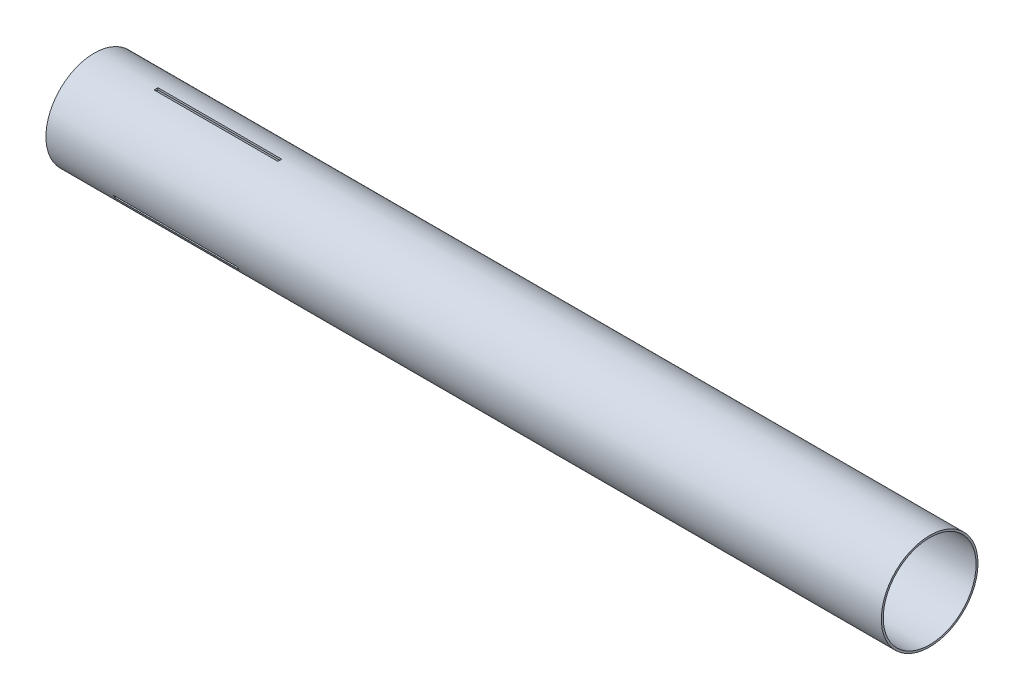
from build123d import *

# Parameters (mm, degrees)
SKETCH1_R           = 39.6748
SKETCH1_R_2         = 38.1
BOSS_EXTRUDE1_DEPTH = 685.8
CUT_EXTRUDE2_DEPTH  = 101.6


with BuildPart() as part:
    # Sketch1 → Boss-Extrude1 (new body)
    with BuildSketch(Plane(origin=(0, 0, 0), x_dir=(0, 0, -1), z_dir=(1, 0, 0))):
        Circle(SKETCH1_R)
        Circle(SKETCH1_R_2, mode=Mode.SUBTRACT)
    extrude(amount=BOSS_EXTRUDE1_DEPTH)

    # Sketch2 → Cut-Extrude2 (cut)
    with BuildSketch(Plane.ZY.offset(-50.8)):
        with BuildLine():
            Line((-1.5875, 39.643027114), (-1.5875, 38.066912716))
            ThreePointArc((-1.5875, 38.066912716), (0, 38.1), (1.5875, 38.066912716))
            Line((1.5875, 38.066912716), (1.5875, 39.643027114))
            ThreePointArc((1.5875, 39.643027114), (0, 39.6748), (-1.5875, 39.643027114))
        make_face()
        with BuildLine():
            Line((35.125618564, -18.446698229), (33.760663456, -17.65864103))
            ThreePointArc((33.760663456, -17.65864103), (32.995567884, -19.05), (32.173163456, -20.408271687))
            Line((32.173163456, -20.408271687), (33.538118564, -21.196328886))
            ThreePointArc((33.538118564, -21.196328886), (34.35938469, -19.8374), (35.125618564, -18.446698229))
        make_face()
        with BuildLine():
            Line((-33.538118564, -21.196328886), (-32.173163456, -20.408271687))
            ThreePointArc((-32.173163456, -20.408271687), (-32.995567884, -19.05), (-33.760663456, -17.65864103))
            Line((-33.760663456, -17.65864103), (-35.125618564, -18.446698229))
            ThreePointArc((-35.125618564, -18.446698229), (-34.35938469, -19.8374), (-33.538118564, -21.196328886))
        make_face()
    extrude(amount=-CUT_EXTRUDE2_DEPTH, mode=Mode.SUBTRACT)


solid = part.part
